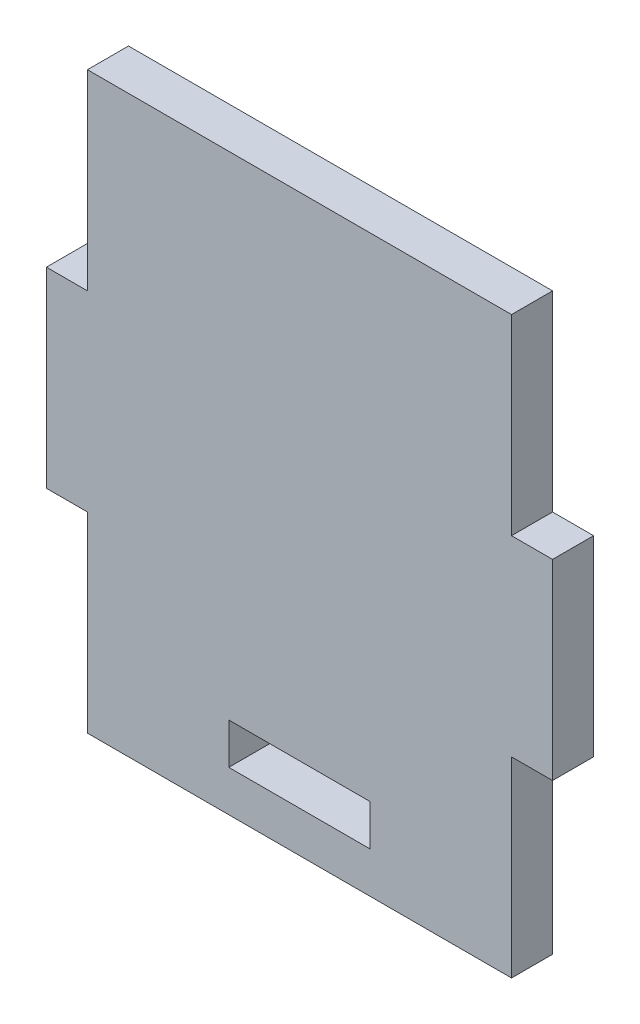
from build123d import *

# Parameters (mm, degrees)
ESQUISSE1_W        = 31
ESQUISSE1_H        = 42
ESQUISSE1_W_2      = 10.34
ESQUISSE1_H_2      = 3
ESQUISSE1_W_3      = 3
ESQUISSE1_H_3      = 14
BOSS_EXTRU_1_DEPTH = 3


with BuildPart() as part:
    # Esquisse1 → Boss.-Extru.1 (new body)
    # profile 1 of 3: a face of its own
    with BuildSketch(Plane.XY):
        with Locations((15.5, 21)):
            Rectangle(ESQUISSE1_W, ESQUISSE1_H)
        with Locations((15.5, 4.5)):
            Rectangle(ESQUISSE1_W_2, ESQUISSE1_H_2, mode=Mode.SUBTRACT)
    # profile 2 of 3: a face of its own
    with BuildSketch(Plane.XY):
        with Locations((-1.5, 21)):
            Rectangle(ESQUISSE1_W_3, ESQUISSE1_H_3)
    # profile 3 of 3: a face of its own
    with BuildSketch(Plane.XY):
        with Locations((32.5, 21)):
            Rectangle(ESQUISSE1_W_3, ESQUISSE1_H_3)
    extrude(amount=BOSS_EXTRU_1_DEPTH)


solid = part.part
